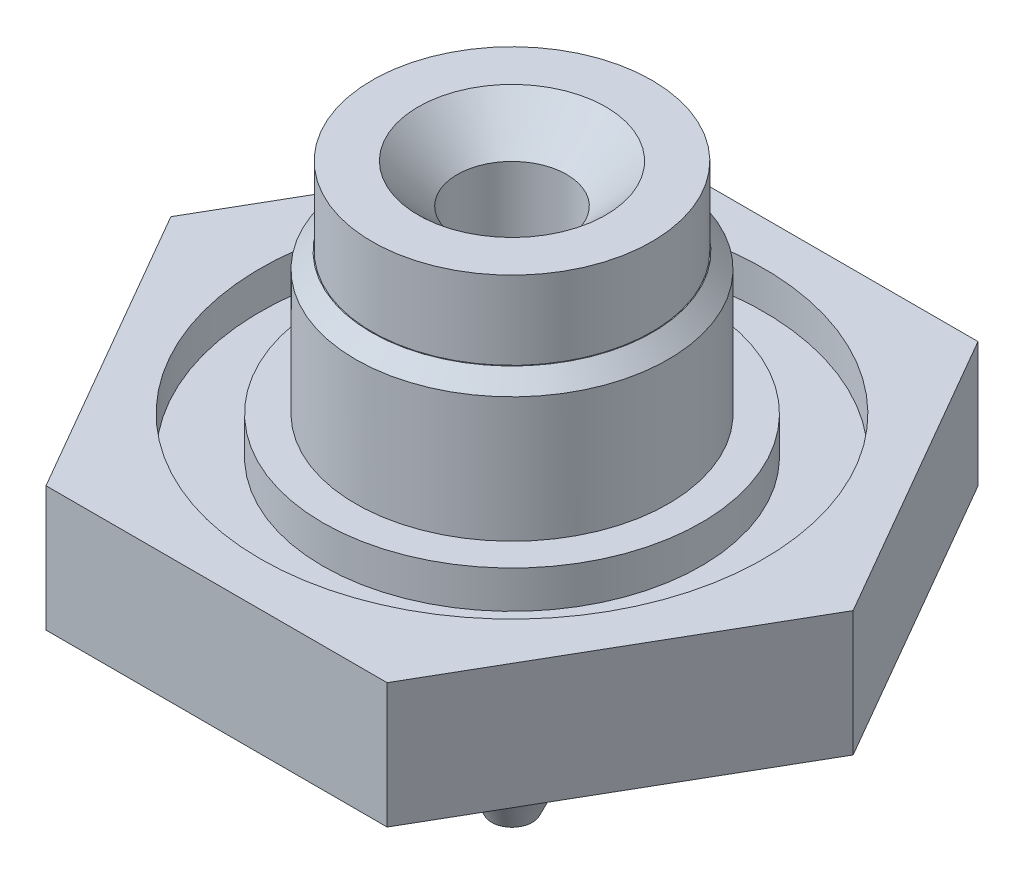
from build123d import *

# Parameters (mm, degrees)
CHANFREIN1_SIZE         = 0.5
ESQUISSE2_R             = 12.5
ENL_V_MAT_EXTRU_1_DEPTH = 21.820662814
ESQUISSE3_R             = 8.05
ESQUISSE3_R_2           = 6.05
ENL_V_MAT_EXTRU_2_DEPTH = 1.2


with BuildPart() as part:
    # Esquisse1 → Révolution1 (revolve)
    with BuildSketch(Plane.XY, mode=Mode.PRIVATE) as r_volution1_sk:
        Polygon((0.65, 0), (0.65, 2.5), (1.75, 3.6), (1.75, 16.75), (3, 18), (4.475, 18), (4.475, 15.5), (5, 15.5), (5, 11), (12.5, 11), (12.5, 7), (3.914153607, 7), align=None)
    revolve(r_volution1_sk.sketch.rotate(Axis((0, 0, 0), (0, 1, 0)), 90), axis=Axis((0, 0, 0), (0, 1, 0)))

    # Chanfrein1
    chanfrein1_edges = [part.edges().sort_by_distance(p)[0] for p in [
        (0, 15.5, 5),
    ]]
    chamfer(chanfrein1_edges, length=CHANFREIN1_SIZE)

    # Esquisse2 → Enlèv. mat.-Extru.1 (cut, through all)
    with BuildSketch(Plane(origin=(0, 11, 0), x_dir=(1, 0, 0), z_dir=(0, 1, 0))):
        Circle(ESQUISSE2_R)
        Polygon((-10.911920088, 0), (-5.455960044, 9.45), (5.455960044, 9.45), (10.911920088, 0), (5.455960044, -9.45), (-5.455960044, -9.45), align=None, mode=Mode.SUBTRACT)
    extrude(amount=-ENL_V_MAT_EXTRU_1_DEPTH, mode=Mode.SUBTRACT)

    # Esquisse3 → Enlèv. mat.-Extru.2 (cut)
    with BuildSketch(Plane(origin=(0, 11, 0), x_dir=(1, 0, 0), z_dir=(0, 1, 0))):
        with Locations(Location((0, 0, 0), (0, 0, 270))):
            Circle(ESQUISSE3_R)
        with Locations(Location((0, 0, 0), (0, 0, 270))):
            Circle(ESQUISSE3_R_2, mode=Mode.SUBTRACT)
    extrude(amount=-ENL_V_MAT_EXTRU_2_DEPTH, mode=Mode.SUBTRACT)


solid = part.part
